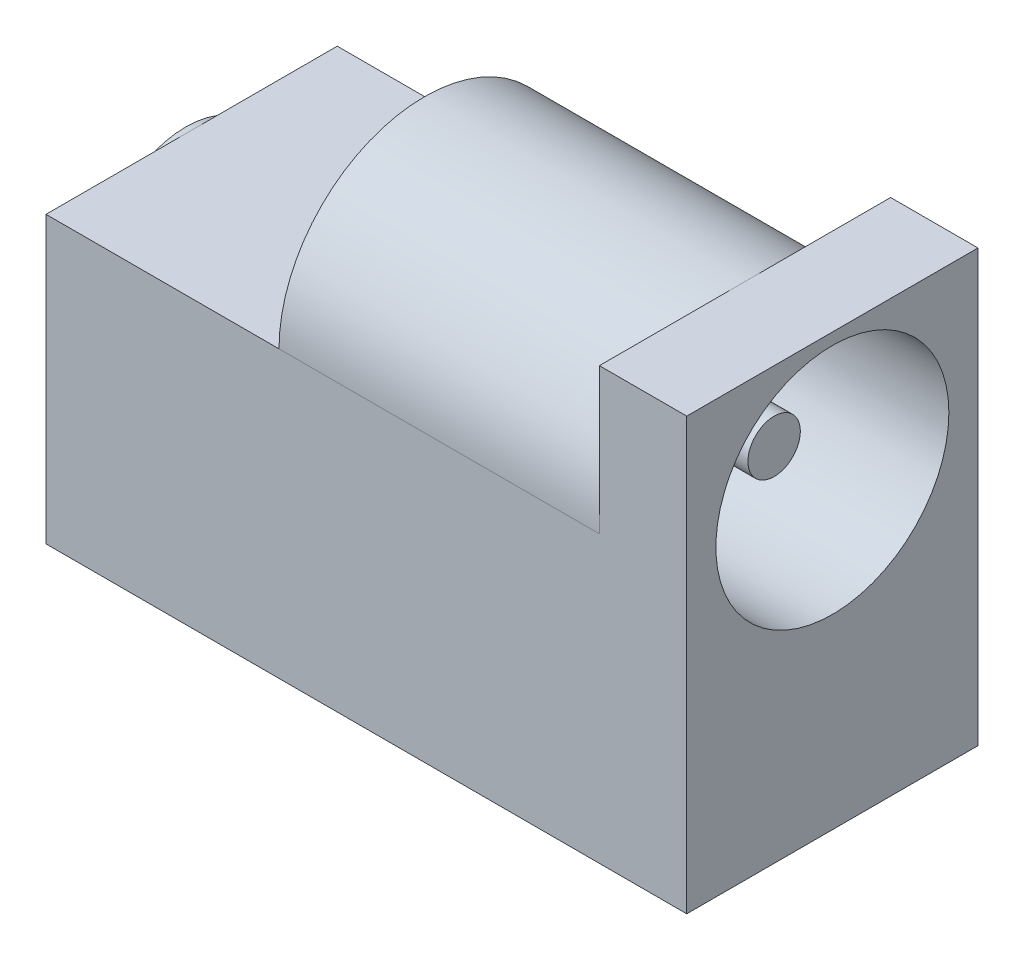
from build123d import *

# Parameters (mm, degrees)
CROQUIS1_W     = 5
CROQUIS1_H     = 7.4
EXTRUIR1_DEPTH = 0.75
EXTRUIR2_DEPTH = 5.5
CROQUIS3_W     = 5
CROQUIS3_H     = 4.9
EXTRUIR3_DEPTH = 4
CROQUIS4_R     = 2
EXTRUIR4_DEPTH = 6
CROQUIS5_R     = 0.5
EXTRUIR5_DEPTH = 2
CROQUIS6_R     = 0.45
EXTRUIR6_DEPTH = 3
EXTRUIR7_DEPTH = 0.1
CROQUIS8_R     = 0.385516529
EXTRUIR8_DEPTH = 0.1
EXTRUIR9_DEPTH = 0.1


with BuildPart() as part:
    # Croquis1 → Extruir1 (new, symmetric)
    with BuildSketch(Plane(origin=(0, 0, 0), x_dir=(0, 0, -1), z_dir=(1, 0, 0))):
        Rectangle(CROQUIS1_W, CROQUIS1_H)
    extrude(amount=EXTRUIR1_DEPTH, both=True)

    # Croquis2 → Extruir2 (add)
    with BuildSketch(Plane.ZY.offset(0.75)):
        with BuildLine():
            Line((-2.5, -3.7), (-2.5, 1.2))
            ThreePointArc((-2.5, 1.2), (0, 3.7), (2.5, 1.2))
            Line((2.5, 1.2), (2.5, -3.7))
            Line((2.5, -3.7), (-2.5, -3.7))
        make_face()
    extrude(amount=EXTRUIR2_DEPTH)

    # Croquis3 → Extruir3 (add)
    with BuildSketch(Plane.ZY.offset(6.25)):
        with Locations((0, -1.25)):
            Rectangle(CROQUIS3_W, CROQUIS3_H)
    extrude(amount=EXTRUIR3_DEPTH)

    # Croquis4 → Extruir4 (cut)
    with BuildSketch(Plane(origin=(0.75, 0, 0), x_dir=(0, 0, -1), z_dir=(1, 0, 0))):
        with Locations((0, 1.5)):
            Circle(CROQUIS4_R)
    extrude(amount=-EXTRUIR4_DEPTH, mode=Mode.SUBTRACT)

    # Croquis5 → Extruir5 (add)
    with BuildSketch(Plane(origin=(-5.25, 0, 0), x_dir=(0, 0, -1), z_dir=(1, 0, 0))):
        with Locations((0, 1.5)):
            Circle(CROQUIS5_R)
    extrude(amount=EXTRUIR5_DEPTH)

    # Croquis6 → Extruir6 (add)
    with BuildSketch(Plane(origin=(-3.25, 0, 0), x_dir=(0, 0, -1), z_dir=(1, 0, 0))):
        with Locations((0, 1.5)):
            Circle(CROQUIS6_R)
    extrude(amount=EXTRUIR6_DEPTH)

    # Croquis7 → Extruir7 (add)
    with BuildSketch(Plane.ZY.offset(10.25)):
        with BuildLine():
            Line((-1.5, -3.7), (-1.5, -0.3))
            ThreePointArc((-1.5, -0.3), (0, 1.2), (1.5, -0.3))
            Line((1.5, -0.3), (1.5, -3.7))
            Line((1.5, -3.7), (0.5, -3.7))
            Line((0.5, -3.7), (0.5, -4.7))
            ThreePointArc((0.5, -4.7), (0, -5.2), (-0.5, -4.7))
            Line((-0.5, -4.7), (-0.5, -3.7))
            Line((-0.5, -3.7), (-1.5, -3.7))
        make_face()
    extrude(amount=EXTRUIR7_DEPTH)

    # Croquis8 → Extruir8 (add)
    with BuildSketch(Plane.ZY.offset(10.35)):
        Circle(CROQUIS8_R)
    extrude(amount=EXTRUIR8_DEPTH)

    # Croquis9 → Extruir9 (add)
    with BuildSketch(Plane(origin=(0, 0, -2.5), x_dir=(-1, 0, 0), z_dir=(0, 0, -1))):
        Polygon((7.85, -3.7), (8.268709763, -4.118709763), (8.268709763, -5.1974269), (8.6, -5.528717137), (8.931290237, -5.1974269), (8.931290237, -4.118709763), (9.35, -3.7), (9.35, -1.3), (7.85, -1.3), align=None)
    extrude(amount=EXTRUIR9_DEPTH)


solid = part.part
